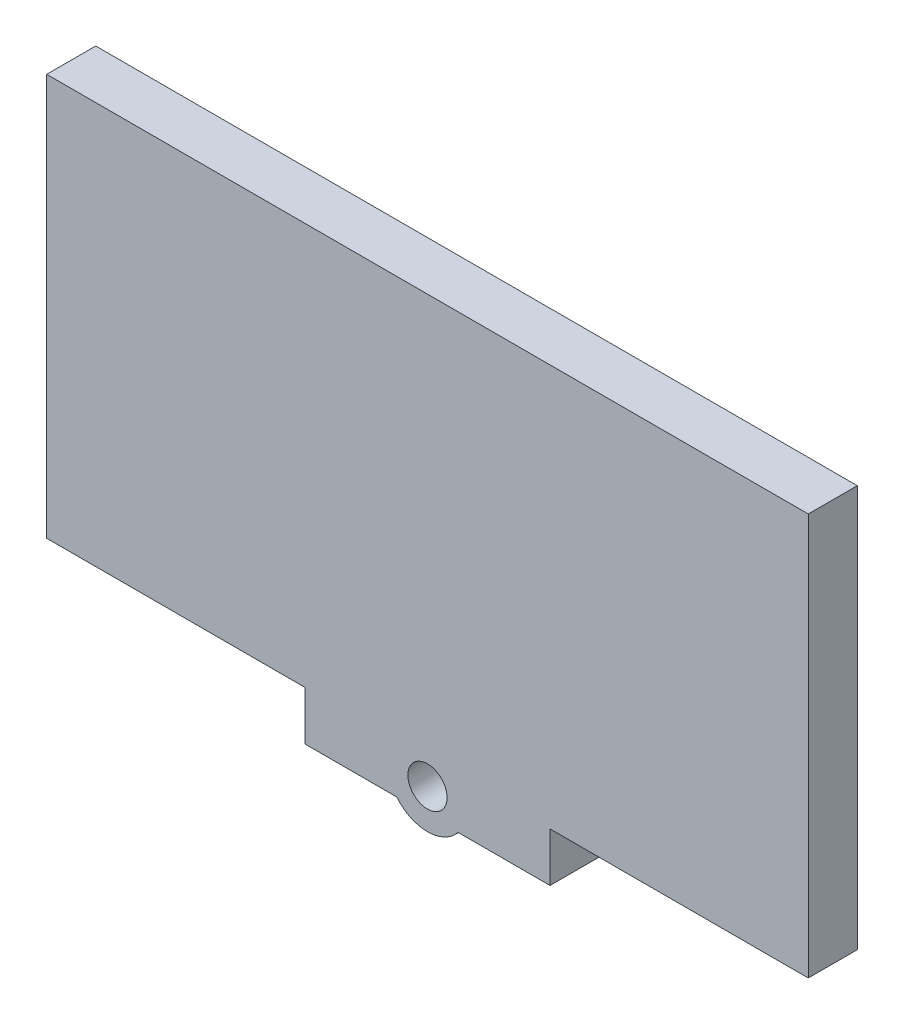
from build123d import *

# Parameters (mm, degrees)
SKETCH1_W           = 77.7
SKETCH1_H           = 41
BOSS_EXTRUDE1_DEPTH = 5
SKETCH2_W           = 25
SKETCH2_H           = 5
BOSS_EXTRUDE2_DEPTH = 5
SKETCH3_R           = 2
CUT_EXTRUDE1_DEPTH  = 5
SKETCH4_R           = 4
SKETCH4_R_2         = 2
BOSS_EXTRUDE3_DEPTH = 5


with BuildPart() as part:
    # Sketch1 → Boss-Extrude1 (new body)
    with BuildSketch(Plane.XY):
        Rectangle(SKETCH1_W, SKETCH1_H)
    extrude(amount=BOSS_EXTRUDE1_DEPTH)

    # Sketch2 → Boss-Extrude2 (add)
    with BuildSketch(Plane.XY.offset(5)):
        with Locations((0, -23)):
            Rectangle(SKETCH2_W, SKETCH2_H)
    extrude(amount=-BOSS_EXTRUDE2_DEPTH)

    # Sketch3 → Cut-Extrude1 (cut)
    with BuildSketch(Plane.XY.offset(5)):
        with Locations((-0.001489704, -23)):
            Circle(SKETCH3_R)
    extrude(amount=-CUT_EXTRUDE1_DEPTH, mode=Mode.SUBTRACT)

    # Sketch4 → Boss-Extrude3 (add)
    with BuildSketch(Plane.XY.offset(5)):
        with Locations((-0.001489704, -23)):
            Circle(SKETCH4_R)
        with Locations((-0.001489704, -23)):
            Circle(SKETCH4_R_2, mode=Mode.SUBTRACT)
    extrude(amount=-BOSS_EXTRUDE3_DEPTH)


solid = part.part
